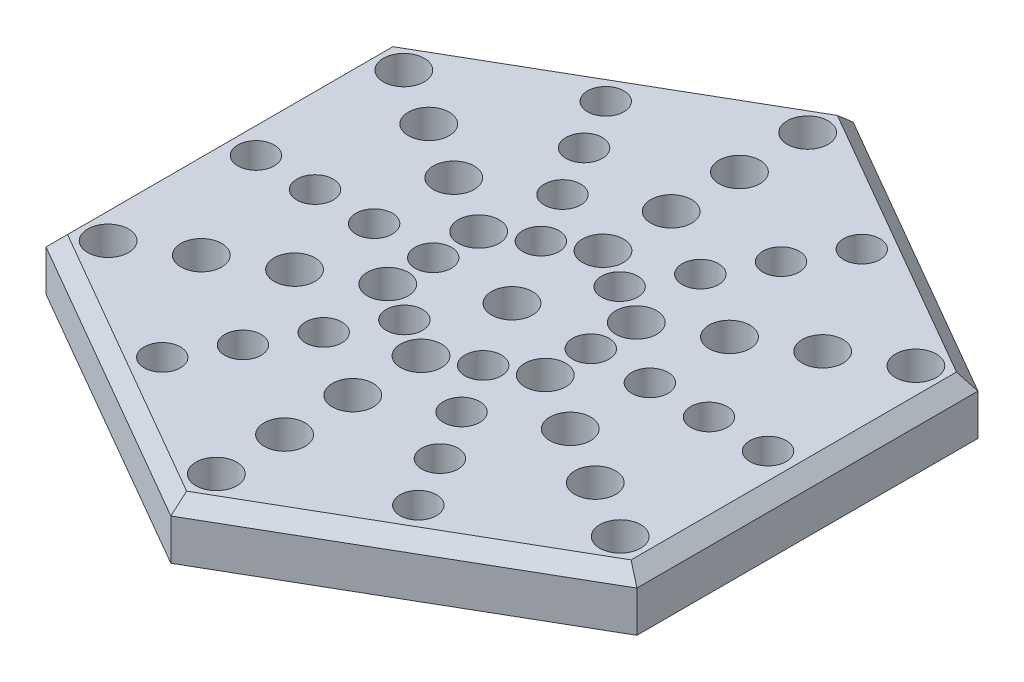
from build123d import *

# Parameters (mm, degrees)
ESQUISSE1_R        = 4.5
ESQUISSE1_R_2      = 4
BOSS_EXTRU_1_DEPTH = 12
CHANFREIN1_SIZE    = 3


with BuildPart() as part:
    # Esquisse1 → Boss.-Extru.1 (new body)
    with BuildSketch(Plane(origin=(0, 0, 0), x_dir=(1, 0, 0), z_dir=(0, 1, 0))):
        Polygon((0, -75), (64.951905284, -37.5), (64.951905284, 37.5), (0, 75), (-64.951905284, 37.5), (-64.951905284, -37.5), align=None)
        with Locations(Location((0, 0, 0), (0, 0, 270))):
            Circle(ESQUISSE1_R, mode=Mode.SUBTRACT)
        with Locations(Location((0, 20, 0), (0, 0, 270))):
            Circle(ESQUISSE1_R, mode=Mode.SUBTRACT)
        with Locations(Location((0, 35, 0), (0, 0, 270))):
            Circle(ESQUISSE1_R, mode=Mode.SUBTRACT)
        with Locations(Location((0, 50, 0), (0, 0, 270))):
            Circle(ESQUISSE1_R, mode=Mode.SUBTRACT)
        with Locations(Location((0, 65, 0), (0, 0, 270))):
            Circle(ESQUISSE1_R, mode=Mode.SUBTRACT)
        with Locations(Location((17.320508076, 10, 0), (0, 0, 270))):
            Circle(ESQUISSE1_R, mode=Mode.SUBTRACT)
        with Locations(Location((30.310889132, 17.5, 0), (0, 0, 270))):
            Circle(ESQUISSE1_R, mode=Mode.SUBTRACT)
        with Locations(Location((43.301270189, 25, 0), (0, 0, 270))):
            Circle(ESQUISSE1_R, mode=Mode.SUBTRACT)
        with Locations(Location((56.291651246, 32.5, 0), (0, 0, 270))):
            Circle(ESQUISSE1_R, mode=Mode.SUBTRACT)
        with Locations(Location((17.320508076, -10, 0), (0, 0, 270))):
            Circle(ESQUISSE1_R, mode=Mode.SUBTRACT)
        with Locations(Location((30.310889132, -17.5, 0), (0, 0, 270))):
            Circle(ESQUISSE1_R, mode=Mode.SUBTRACT)
        with Locations(Location((43.301270189, -25, 0), (0, 0, 270))):
            Circle(ESQUISSE1_R, mode=Mode.SUBTRACT)
        with Locations(Location((56.291651246, -32.5, 0), (0, 0, 270))):
            Circle(ESQUISSE1_R, mode=Mode.SUBTRACT)
        with Locations(Location((0, -20, 0), (0, 0, 270))):
            Circle(ESQUISSE1_R, mode=Mode.SUBTRACT)
        with Locations(Location((0, -35, 0), (0, 0, 270))):
            Circle(ESQUISSE1_R, mode=Mode.SUBTRACT)
        with Locations(Location((0, -50, 0), (0, 0, 270))):
            Circle(ESQUISSE1_R, mode=Mode.SUBTRACT)
        with Locations(Location((0, -65, 0), (0, 0, 270))):
            Circle(ESQUISSE1_R, mode=Mode.SUBTRACT)
        with Locations(Location((-17.320508076, -10, 0), (0, 0, 270))):
            Circle(ESQUISSE1_R, mode=Mode.SUBTRACT)
        with Locations(Location((-30.310889132, -17.5, 0), (0, 0, 270))):
            Circle(ESQUISSE1_R, mode=Mode.SUBTRACT)
        with Locations(Location((-43.301270189, -25, 0), (0, 0, 270))):
            Circle(ESQUISSE1_R, mode=Mode.SUBTRACT)
        with Locations(Location((-56.291651246, -32.5, 0), (0, 0, 270))):
            Circle(ESQUISSE1_R, mode=Mode.SUBTRACT)
        with Locations(Location((-17.320508076, 10, 0), (0, 0, 270))):
            Circle(ESQUISSE1_R, mode=Mode.SUBTRACT)
        with Locations(Location((-30.310889132, 17.5, 0), (0, 0, 270))):
            Circle(ESQUISSE1_R, mode=Mode.SUBTRACT)
        with Locations(Location((-43.301270189, 25, 0), (0, 0, 270))):
            Circle(ESQUISSE1_R, mode=Mode.SUBTRACT)
        with Locations(Location((-56.291651246, 32.5, 0), (0, 0, 270))):
            Circle(ESQUISSE1_R, mode=Mode.SUBTRACT)
        with Locations(Location((17.320508076, 0, 0), (0, 0, 270))):
            Circle(ESQUISSE1_R_2, mode=Mode.SUBTRACT)
        with Locations(Location((30.310889132, 0, 0), (0, 0, 270))):
            Circle(ESQUISSE1_R_2, mode=Mode.SUBTRACT)
        with Locations(Location((43.301270189, 0, 0), (0, 0, 270))):
            Circle(ESQUISSE1_R_2, mode=Mode.SUBTRACT)
        with Locations(Location((56.291651246, 0, 0), (0, 0, 270))):
            Circle(ESQUISSE1_R_2, mode=Mode.SUBTRACT)
        with Locations(Location((8.660254038, -15, 0), (0, 0, 270))):
            Circle(ESQUISSE1_R_2, mode=Mode.SUBTRACT)
        with Locations(Location((15.155444566, -26.25, 0), (0, 0, 270))):
            Circle(ESQUISSE1_R_2, mode=Mode.SUBTRACT)
        with Locations(Location((21.650635095, -37.5, 0), (0, 0, 270))):
            Circle(ESQUISSE1_R_2, mode=Mode.SUBTRACT)
        with Locations(Location((28.145825623, -48.75, 0), (0, 0, 270))):
            Circle(ESQUISSE1_R_2, mode=Mode.SUBTRACT)
        with Locations(Location((-8.660254038, -15, 0), (0, 0, 270))):
            Circle(ESQUISSE1_R_2, mode=Mode.SUBTRACT)
        with Locations(Location((-15.155444566, -26.25, 0), (0, 0, 270))):
            Circle(ESQUISSE1_R_2, mode=Mode.SUBTRACT)
        with Locations(Location((-21.650635095, -37.5, 0), (0, 0, 270))):
            Circle(ESQUISSE1_R_2, mode=Mode.SUBTRACT)
        with Locations(Location((-28.145825623, -48.75, 0), (0, 0, 270))):
            Circle(ESQUISSE1_R_2, mode=Mode.SUBTRACT)
        with Locations(Location((-17.320508076, 0, 0), (0, 0, 270))):
            Circle(ESQUISSE1_R_2, mode=Mode.SUBTRACT)
        with Locations(Location((-30.310889132, 0, 0), (0, 0, 270))):
            Circle(ESQUISSE1_R_2, mode=Mode.SUBTRACT)
        with Locations(Location((-43.301270189, 0, 0), (0, 0, 270))):
            Circle(ESQUISSE1_R_2, mode=Mode.SUBTRACT)
        with Locations(Location((-56.291651246, 0, 0), (0, 0, 270))):
            Circle(ESQUISSE1_R_2, mode=Mode.SUBTRACT)
        with Locations(Location((-8.660254038, 15, 0), (0, 0, 270))):
            Circle(ESQUISSE1_R_2, mode=Mode.SUBTRACT)
        with Locations(Location((-15.155444566, 26.25, 0), (0, 0, 270))):
            Circle(ESQUISSE1_R_2, mode=Mode.SUBTRACT)
        with Locations(Location((-21.650635095, 37.5, 0), (0, 0, 270))):
            Circle(ESQUISSE1_R_2, mode=Mode.SUBTRACT)
        with Locations(Location((-28.145825623, 48.75, 0), (0, 0, 270))):
            Circle(ESQUISSE1_R_2, mode=Mode.SUBTRACT)
        with Locations(Location((8.660254038, 15, 0), (0, 0, 270))):
            Circle(ESQUISSE1_R_2, mode=Mode.SUBTRACT)
        with Locations(Location((15.155444566, 26.25, 0), (0, 0, 270))):
            Circle(ESQUISSE1_R_2, mode=Mode.SUBTRACT)
        with Locations(Location((21.650635095, 37.5, 0), (0, 0, 270))):
            Circle(ESQUISSE1_R_2, mode=Mode.SUBTRACT)
        with Locations(Location((28.145825623, 48.75, 0), (0, 0, 270))):
            Circle(ESQUISSE1_R_2, mode=Mode.SUBTRACT)
    extrude(amount=BOSS_EXTRU_1_DEPTH)

    # Chanfrein1
    chanfrein1_edges = [part.edges().sort_by_distance(p)[0] for p in [
        (32.475952642, 12, 56.25),
        (64.951905284, 12, 0),
        (32.475952642, 12, -56.25),
        (-32.475952642, 12, -56.25),
        (-64.951905284, 12, 0),
        (-32.475952642, 12, 56.25),
    ]]
    chamfer(chanfrein1_edges, length=CHANFREIN1_SIZE)


solid = part.part
